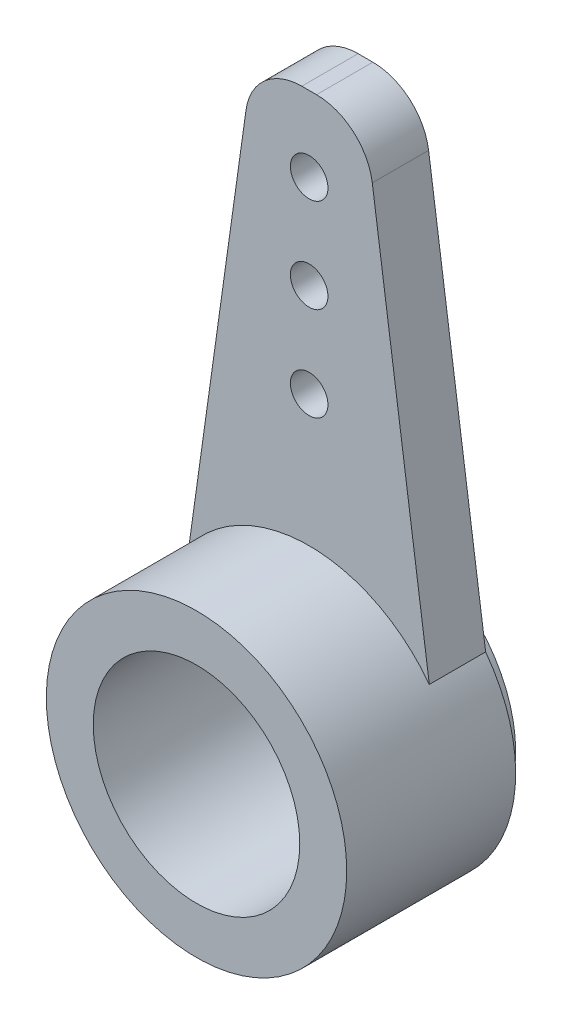
from build123d import *
from build123d.topology import SkipClean

# Parameters (mm, degrees)
SKETCH1_R           = 0.5
SKETCH1_R_2         = 1.5
BOSS_EXTRUDE3_DEPTH = 1.5
SKETCH2_R           = 4
BOSS_EXTRUDE4_DEPTH = 3
SKETCH3_R           = 3.5
SKETCH3_R_2         = 3.25
BOSS_EXTRUDE5_DEPTH = 0.5
SKETCH4_R           = 2.75
CUT_EXTRUDE1_DEPTH  = 4


with BuildPart() as part:
    # Sketch1 → Boss-Extrude3 (new body)
    with BuildSketch(Plane.XY):
        with BuildLine():
            Line((-3.2, 2.4), (-1.681423136, 13.208694151))
            ThreePointArc((-1.681423136, 13.208694151), (-1.180125332, 14.132042673), (-0.196011829, 14.5))
            Line((-0.196011829, 14.5), (0.196011829, 14.5))
            ThreePointArc((0.196011829, 14.5), (1.180125332, 14.132042673), (1.681423136, 13.208694151))
            Line((1.681423136, 13.208694151), (3.2, 2.4))
            ThreePointArc((3.2, 2.4), (0, -4), (-3.2, 2.4))
        make_face()
        with Locations((0, 10)):
            Circle(SKETCH1_R, mode=Mode.SUBTRACT)
        with Locations((0, 12.5)):
            Circle(SKETCH1_R, mode=Mode.SUBTRACT)
        with Locations((0, 7.5)):
            Circle(SKETCH1_R, mode=Mode.SUBTRACT)
        Circle(SKETCH1_R_2, mode=Mode.SUBTRACT)
    extrude(amount=BOSS_EXTRUDE3_DEPTH)

    # Sketch2 → Boss-Extrude4 (add)
    with SkipClean():  # the faces are left unmerged after this step: merging them gives an invalid solid
        with BuildSketch(Plane.XY.offset(1.5)):
            with Locations(Location((0, 0, 0), (0, 0, 143.130102354))):
                Circle(SKETCH2_R)
        extrude(amount=BOSS_EXTRUDE4_DEPTH)

    # Sketch3 → Boss-Extrude5 (add)
    with SkipClean():  # the faces are left unmerged after this step: merging them gives an invalid solid
        with BuildSketch(Plane(origin=(0, 0, 0), x_dir=(-1, 0, 0), z_dir=(0, 0, -1))):
            with Locations(Location((0, 0, 0), (0, 0, 180))):
                Circle(SKETCH3_R)
            Circle(SKETCH3_R_2, mode=Mode.SUBTRACT)
        extrude(amount=BOSS_EXTRUDE5_DEPTH)

    # Sketch4 → Cut-Extrude1 (cut)
    with SkipClean():  # the faces are left unmerged after this step: merging them gives an invalid solid
        with BuildSketch(Plane.XY.offset(4.5)):
            Circle(SKETCH4_R)
        extrude(amount=-CUT_EXTRUDE1_DEPTH, mode=Mode.SUBTRACT)


solid = part.part
